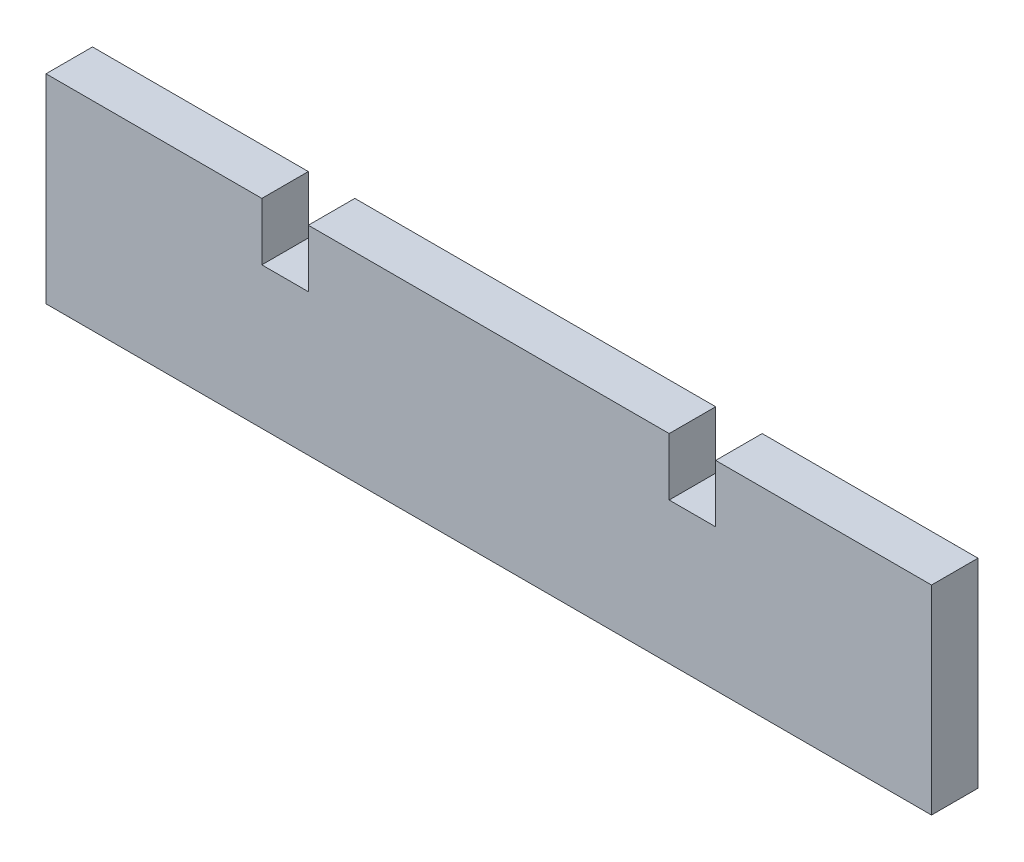
from build123d import *

# Parameters (mm, degrees)
SKETCH1_W           = 101.6
SKETCH1_H           = 22.86
BOSS_EXTRUDE1_DEPTH = 5.334
SKETCH2_W           = 5.334
SKETCH2_H           = 6.604
CUT_EXTRUDE1_DEPTH  = 74.320853754


with BuildPart() as part:
    # Sketch1 → Boss-Extrude1 (new body)
    with BuildSketch(Plane.XY):
        with Locations((-9.593986812, -29.801812913)):
            Rectangle(SKETCH1_W, SKETCH1_H)
    extrude(amount=BOSS_EXTRUDE1_DEPTH)

    # Sketch2 → Cut-Extrude1 (cut, through all)
    with BuildSketch(Plane.XY.offset(5.334)):
        with Locations((-32.961986812, -21.673812913)):
            Rectangle(SKETCH2_W, SKETCH2_H)
        with Locations((13.774013188, -21.673812913)):
            Rectangle(SKETCH2_W, SKETCH2_H)
    extrude(amount=-CUT_EXTRUDE1_DEPTH, mode=Mode.SUBTRACT)


solid = part.part
